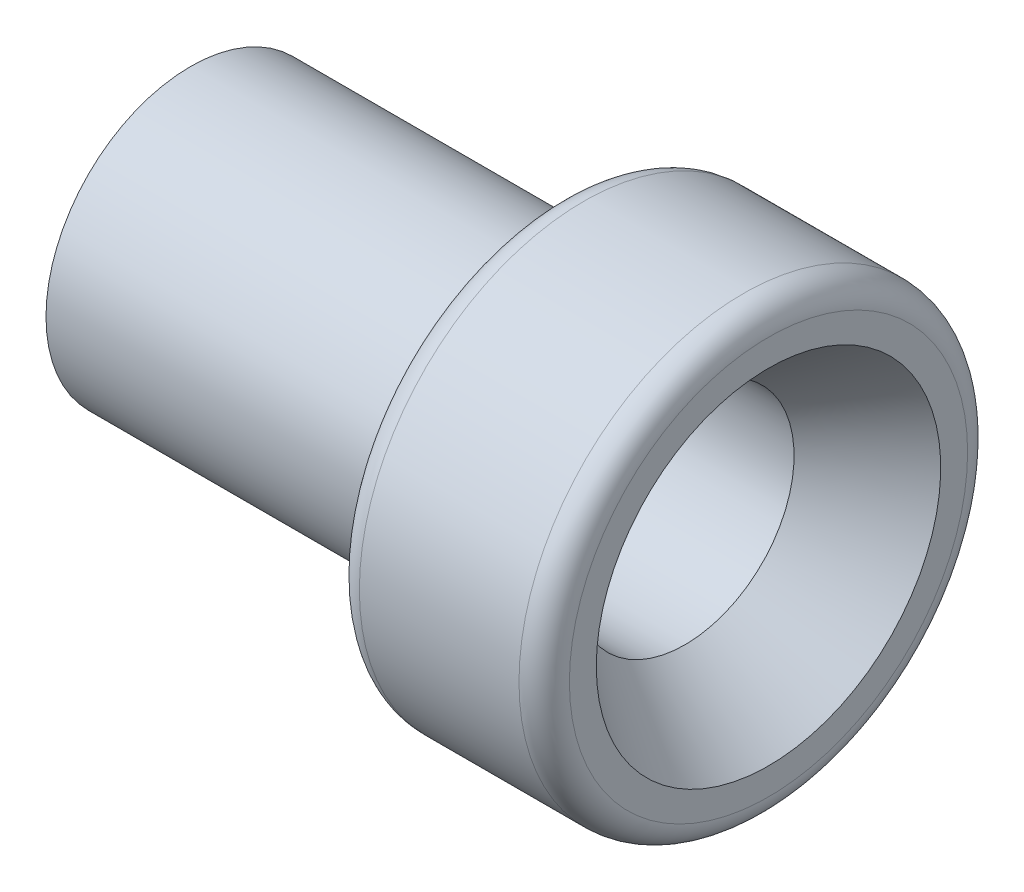
from build123d import *


with BuildPart() as part:
    # Sketch1 → Revolve1 (revolve)
    with BuildSketch(Plane.XY, mode=Mode.PRIVATE) as revolve1_sk:
        with BuildLine():
            Line((-4.3688, 1.651), (3.104789807, 1.651))
            Line((3.104789807, 1.651), (4.3688, 2.6035))
            Line((4.3688, 2.6035), (4.3688, 3.0099))
            ThreePointArc((4.3688, 3.0099), (4.257207684, 3.279307684), (3.9878, 3.3909))
            Line((3.9878, 3.3909), (1.5748, 3.3909))
            ThreePointArc((1.5748, 3.3909), (1.305392316, 3.279307684), (1.1938, 3.0099))
            Line((1.1938, 3.0099), (1.1938, 2.1844))
            Line((1.1938, 2.1844), (-4.3688, 2.1844))
            Line((-4.3688, 2.1844), (-4.3688, 1.651))
        make_face()
    revolve(revolve1_sk.sketch.rotate(Axis((-4.3688, 0, 0), (1, 0, 0)), 90), axis=Axis((-4.3688, 0, 0), (1, 0, 0)))


solid = part.part
